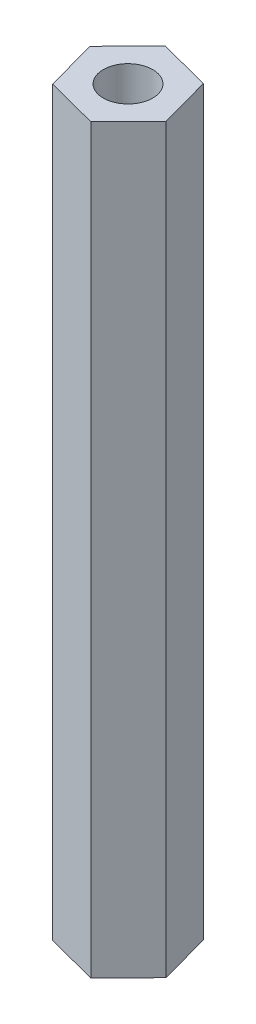
from build123d import *

# Parameters (mm, degrees)
SKETCH_1_R      = 1.5
EXTRUDE_1_DEPTH = 45


with BuildPart() as part:
    # 草图1 → 凸台-拉伸1 (new body)
    with BuildSketch(Plane(origin=(0, 0, 0), x_dir=(1, 0, 0), z_dir=(0, 1, 0))):
        Polygon((0.858107762, -3.117207789), (3.128635016, -0.815460773), (2.270527253, 2.301747016), (-0.858107762, 3.117207789), (-3.128635016, 0.815460773), (-2.270527253, -2.301747016), align=None)
        with Locations(Location((0, 0, 0), (0, 0, 90))):
            Circle(SKETCH_1_R, mode=Mode.SUBTRACT)
    extrude(amount=EXTRUDE_1_DEPTH)


solid = part.part
